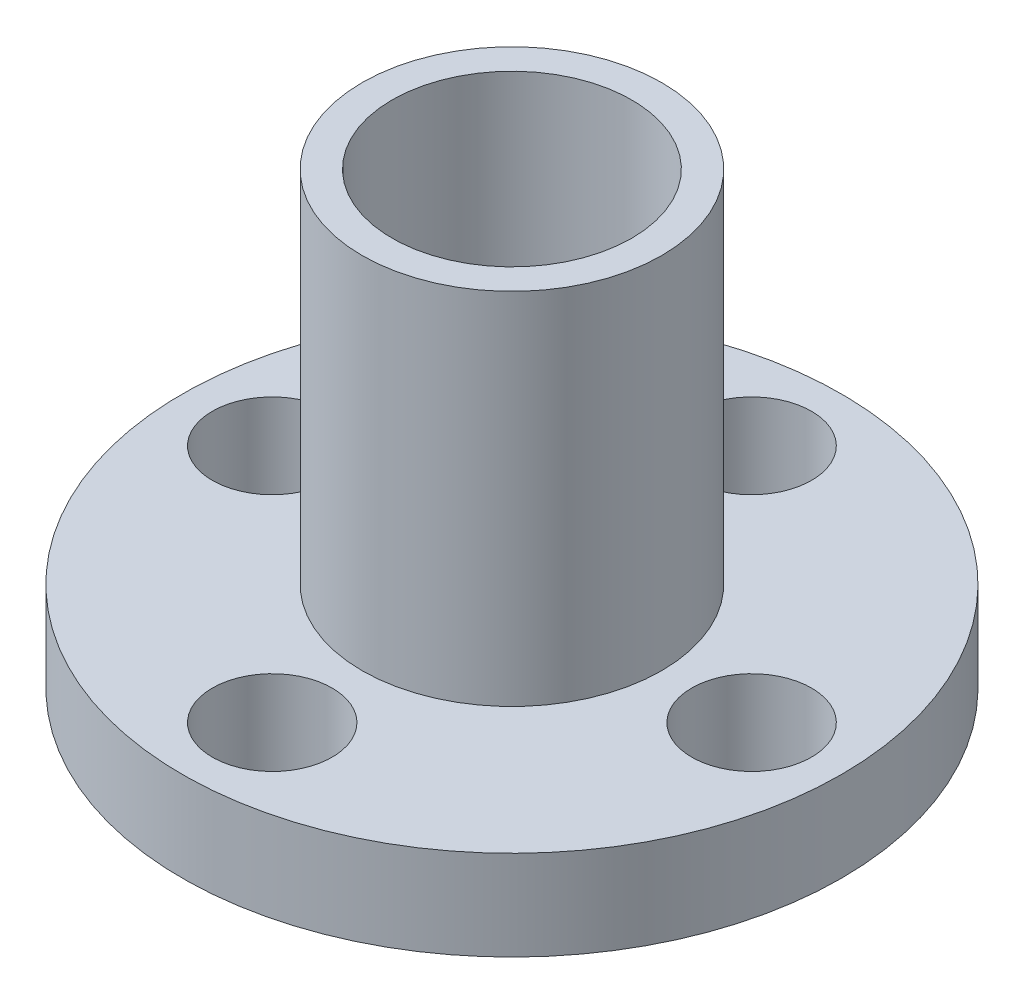
from build123d import *

# Parameters (mm, degrees)
SKETCH2_R          = 2
CUT_EXTRUDE1_DEPTH = 20.646882704


with BuildPart() as part:
    # Sketch1 → Revolve1 (revolve)
    with BuildSketch(Plane.XY, mode=Mode.PRIVATE) as revolve1_sk:
        Polygon((-4, 0), (-11, 0), (-11, 3), (-5, 3), (-5, 15), (-4, 15), align=None)
    revolve(revolve1_sk.sketch.rotate(Axis((0, -177.201778129, 0), (0, 1, 0)), 180), axis=Axis((0, -177.201778129, 0), (0, 1, 0)))

    # Sketch2 → Cut-Extrude1 (cut, through all)
    with BuildSketch(Plane(origin=(0, 3, 0), x_dir=(1, 0, 0), z_dir=(0, 1, 0))):
        with Locations(Location((0, 8, 0), (0, 0, 180))):
            Circle(SKETCH2_R)
        with Locations(Location((8, 0, 0), (0, 0, 180))):
            Circle(SKETCH2_R)
        with Locations(Location((0, -8, 0), (0, 0, 180))):
            Circle(SKETCH2_R)
        with Locations(Location((-8, 0, 0), (0, 0, 180))):
            Circle(SKETCH2_R)
    extrude(amount=-CUT_EXTRUDE1_DEPTH, mode=Mode.SUBTRACT)


solid = part.part
